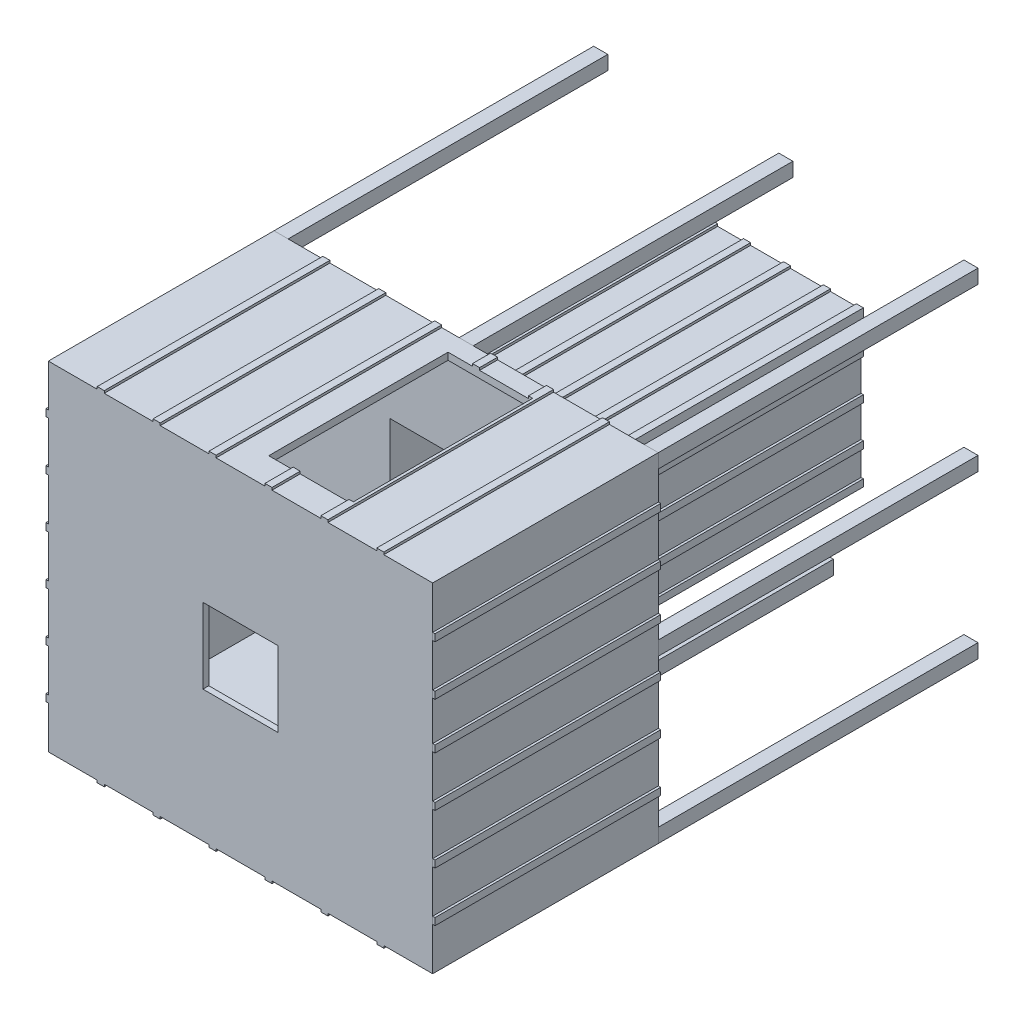
from build123d import *

# Parameters (mm, degrees)
SKETCH1_W               = 4152.9
SKETCH1_H               = 3657.6
SKETCH1_W_2             = 4000.5
SKETCH1_H_2             = 3505.2
BASE_EXTRUDE_DEPTH      = 2438.4
SKETCH2_W               = 4152.9
SKETCH2_H               = 3657.6
SKETCH2_W_2             = 1524
SKETCH2_H_2             = 1524
BOSS_EXTRUDE1_DEPTH     = 63.5
SKETCH3_W               = 4152.9
SKETCH3_H               = 3657.6
SKETCH3_W_2             = 812.8
SKETCH3_H_2             = 812.800001016
BOSS_EXTRUDE2_DEPTH     = 63.5
SKETCH4_W               = 152.4
SKETCH4_H               = 152.4
SKETCH4_W_2             = 142.875
SKETCH4_H_2             = 142.875
BOSS_EXTRUDE3_DEPTH     = 3454.4
SKETCH13_W              = 76.2
SKETCH13_H              = 2438.4
BOSS_EXTRUDE5_DEPTH     = 25.4
SKETCH15_W              = 76.2
SKETCH15_H              = 2438.4
BOSS_EXTRUDE6_DEPTH     = 25.4
SKETCH16_W              = 2438.4
SKETCH16_H              = 76.2
BOSS_EXTRUDE7_DEPTH     = 25.4
BOSS_EXTRUDE7_2_DEPTH   = 25.4
BOSS_EXTRUDE7_3_DEPTH   = 25.4
BOSS_EXTRUDE7_4_DEPTH   = 25.4
BOSS_EXTRUDE7_5_DEPTH   = 25.4
BOSS_EXTRUDE7_6_DEPTH   = 25.4
SKETCH19_W              = 2438.4
SKETCH19_H              = 76.2
BOSS_EXTRUDE8_DEPTH     = 25.4
SKETCH22_W              = 1625.6
SKETCH22_H              = 1625.6
SKETCH22_W_2            = 1524
SKETCH22_H_2            = 1524
BOSS_EXTRUDE9_DEPTH     = 3454.4
SKETCH24_W              = 76.2
SKETCH24_H              = 3454.4
BOSS_EXTRUDE10_DEPTH    = 25.4
SKETCH27_W              = 3454.4
SKETCH27_H              = 76.2
BOSS_EXTRUDE11_DEPTH    = 25.4
SKETCH28_W              = 76.2
SKETCH28_H              = 3454.4
BOSS_EXTRUDE12_DEPTH    = 25.4
SKETCH29_W              = 3454.4
SKETCH29_H              = 76.2
BOSS_EXTRUDE13_DEPTH    = 25.4
CUT_EXTRUDE5_DEPTH      = 293.37
CUT_EXTRUDE5_DEPTH_BACK = 320.04
SKETCH31_W              = 1981.2
SKETCH31_H              = 990.6
CUT_EXTRUDE6_DEPTH      = 320.04
CUT_EXTRUDE6_DEPTH_BACK = 655.574
SKETCH33_W              = 650.421428571
SKETCH33_H              = 2057.4
SKETCH33_W_2            = 527.957142858
BOSS_EXTRUDE15_DEPTH    = 119.38
BOSS_EXTRUDE16_REACH    = 4603.976


with BuildPart() as part:
    # Sketch1 → Base-Extrude (new body)
    with BuildSketch(Plane.XY):
        Rectangle(SKETCH1_W, SKETCH1_H)
        Rectangle(SKETCH1_W_2, SKETCH1_H_2, mode=Mode.SUBTRACT)
    extrude(amount=BASE_EXTRUDE_DEPTH)

    # Sketch2 → Boss-Extrude1 (add)
    with BuildSketch(Plane(origin=(0, 0, 0), x_dir=(-1, 0, 0), z_dir=(0, 0, -1))):
        Rectangle(SKETCH2_W, SKETCH2_H)
        Rectangle(SKETCH2_W_2, SKETCH2_H_2, mode=Mode.SUBTRACT)
    extrude(amount=-BOSS_EXTRUDE1_DEPTH)

    # Sketch3 → Boss-Extrude2 (add)
    with BuildSketch(Plane.XY.offset(2438.4)):
        Rectangle(SKETCH3_W, SKETCH3_H)
        Rectangle(SKETCH3_W_2, SKETCH3_H_2, mode=Mode.SUBTRACT)
    extrude(amount=-BOSS_EXTRUDE2_DEPTH)

    # Sketch4 → Boss-Extrude3 (add)
    # profile 1 of 8: a face of its own
    with BuildSketch(Plane(origin=(0, 0, 0), x_dir=(-1, 0, 0), z_dir=(0, 0, -1))):
        with Locations((2000.25, 1752.6)):
            Rectangle(SKETCH4_W, SKETCH4_H)
        with Locations((2000.25, 1752.6)):
            Rectangle(SKETCH4_W_2, SKETCH4_H_2, mode=Mode.SUBTRACT)
    # profile 2 of 8: a face of its own
    with BuildSketch(Plane(origin=(0, 0, 0), x_dir=(-1, 0, 0), z_dir=(0, 0, -1))):
        with Locations((2000.25, -1752.6)):
            Rectangle(SKETCH4_W, SKETCH4_H)
        with Locations((2000.25, -1752.6)):
            Rectangle(SKETCH4_W_2, SKETCH4_H_2, mode=Mode.SUBTRACT)
    # profile 3 of 8: a face of its own
    with BuildSketch(Plane(origin=(0, 0, 0), x_dir=(-1, 0, 0), z_dir=(0, 0, -1))):
        with Locations((-2000.25, -1752.6)):
            Rectangle(SKETCH4_W, SKETCH4_H)
        with Locations((-2000.25, -1752.6)):
            Rectangle(SKETCH4_W_2, SKETCH4_H_2, mode=Mode.SUBTRACT)
    # profile 4 of 8: a face of its own
    with BuildSketch(Plane(origin=(0, 0, 0), x_dir=(-1, 0, 0), z_dir=(0, 0, -1))):
        with Locations((-2000.25, 1752.6)):
            Rectangle(SKETCH4_W, SKETCH4_H)
        with Locations((-2000.25, 1752.6)):
            Rectangle(SKETCH4_W_2, SKETCH4_H_2, mode=Mode.SUBTRACT)
    # profile 5 of 8: a face of its own
    with BuildSketch(Plane(origin=(0, 0, 0), x_dir=(-1, 0, 0), z_dir=(0, 0, -1))):
        with Locations((0, 1752.6)):
            Rectangle(SKETCH4_W, SKETCH4_H)
        with Locations((0, 1752.6)):
            Rectangle(SKETCH4_W_2, SKETCH4_H_2, mode=Mode.SUBTRACT)
    # profile 6 of 8: a face of its own
    with BuildSketch(Plane(origin=(0, 0, 0), x_dir=(-1, 0, 0), z_dir=(0, 0, -1))):
        with Locations((-438.15, -1752.6)):
            Rectangle(SKETCH4_W, SKETCH4_H)
        with Locations((-438.15, -1752.6)):
            Rectangle(SKETCH4_W_2, SKETCH4_H_2, mode=Mode.SUBTRACT)
    # profile 7 of 8: a face of its own
    with BuildSketch(Plane(origin=(0, 0, 0), x_dir=(-1, 0, 0), z_dir=(0, 0, -1))):
        with Locations((-2000.25, 0)):
            Rectangle(SKETCH4_W, SKETCH4_H)
        with Locations((-2000.25, 0)):
            Rectangle(SKETCH4_W_2, SKETCH4_H_2, mode=Mode.SUBTRACT)
    # profile 8 of 8: a face of its own
    with BuildSketch(Plane(origin=(0, 0, 0), x_dir=(-1, 0, 0), z_dir=(0, 0, -1))):
        with Locations((2000.25, -457.2)):
            Rectangle(SKETCH4_W, SKETCH4_H)
        with Locations((2000.25, -457.2)):
            Rectangle(SKETCH4_W_2, SKETCH4_H_2, mode=Mode.SUBTRACT)
    extrude(amount=BOSS_EXTRUDE3_DEPTH)

    # Sketch13 → Boss-Extrude5 (add)
    with BuildSketch(Plane(origin=(0, 1828.8, 0), x_dir=(1, 0, 0), z_dir=(0, 1, 0))):
        with Locations((1510.392857143, -1219.2)):
            Rectangle(SKETCH13_W, SKETCH13_H)
        with Locations((-1510.392857143, -1219.2)):
            Rectangle(SKETCH13_W, SKETCH13_H)
        with Locations((-906.235714286, -1219.2)):
            Rectangle(SKETCH13_W, SKETCH13_H)
        with Locations((-302.078571429, -1219.2)):
            Rectangle(SKETCH13_W, SKETCH13_H)
        with Locations((302.078571429, -1219.2)):
            Rectangle(SKETCH13_W, SKETCH13_H)
        with Locations((906.235714286, -1219.2)):
            Rectangle(SKETCH13_W, SKETCH13_H)
    extrude(amount=BOSS_EXTRUDE5_DEPTH)

    # Sketch15 → Boss-Extrude6 (add)
    with BuildSketch(Plane.XZ.offset(1828.8)):
        with Locations((-1510.392857143, 1219.2)):
            Rectangle(SKETCH15_W, SKETCH15_H)
        with Locations((-906.235714286, 1219.2)):
            Rectangle(SKETCH15_W, SKETCH15_H)
        with Locations((-302.078571429, 1219.2)):
            Rectangle(SKETCH15_W, SKETCH15_H)
        with Locations((302.078571429, 1219.2)):
            Rectangle(SKETCH15_W, SKETCH15_H)
        with Locations((906.235714286, 1219.2)):
            Rectangle(SKETCH15_W, SKETCH15_H)
        with Locations((1510.392857143, 1219.2)):
            Rectangle(SKETCH15_W, SKETCH15_H)
    extrude(amount=BOSS_EXTRUDE6_DEPTH)

    # Sketch19 → Boss-Extrude8 (add)
    with BuildSketch(Plane.ZY.offset(2076.45)):
        with Locations((1219.2, 1333.5)):
            Rectangle(SKETCH19_W, SKETCH19_H)
        with Locations((1219.2, 800.1)):
            Rectangle(SKETCH19_W, SKETCH19_H)
        with Locations((1219.2, 266.7)):
            Rectangle(SKETCH19_W, SKETCH19_H)
        with Locations((1219.2, -266.7)):
            Rectangle(SKETCH19_W, SKETCH19_H)
        with Locations((1219.2, -800.1)):
            Rectangle(SKETCH19_W, SKETCH19_H)
        with Locations((1219.2, -1333.5)):
            Rectangle(SKETCH19_W, SKETCH19_H)
    extrude(amount=BOSS_EXTRUDE8_DEPTH)

    # Sketch22 → Boss-Extrude9 (add)
    with BuildSketch(Plane(origin=(0, 0, 0), x_dir=(-1, 0, 0), z_dir=(0, 0, -1))):
        Rectangle(SKETCH22_W, SKETCH22_H)
        Rectangle(SKETCH22_W_2, SKETCH22_H_2, mode=Mode.SUBTRACT)
    extrude(amount=BOSS_EXTRUDE9_DEPTH)

    # Sketch24 → Boss-Extrude10 (add)
    with BuildSketch(Plane.XZ.offset(812.8)):
        with Locations((-774.7, -1727.2)):
            Rectangle(SKETCH24_W, SKETCH24_H)
        with Locations((-425.45, -1727.2)):
            Rectangle(SKETCH24_W, SKETCH24_H)
        with Locations((0, -1727.2)):
            Rectangle(SKETCH24_W, SKETCH24_H)
        with Locations((425.45, -1727.2)):
            Rectangle(SKETCH24_W, SKETCH24_H)
        with Locations((774.7, -1727.2)):
            Rectangle(SKETCH24_W, SKETCH24_H)
    extrude(amount=BOSS_EXTRUDE10_DEPTH)

    # Sketch27 → Boss-Extrude11 (add)
    with BuildSketch(Plane(origin=(812.8, 0, 0), x_dir=(0, 0, -1), z_dir=(1, 0, 0))):
        with Locations((1727.2, -800.1)):
            Rectangle(SKETCH27_W, SKETCH27_H)
        with Locations((1727.2, -444.5)):
            Rectangle(SKETCH27_W, SKETCH27_H)
        with Locations((1727.2, -12.7)):
            Rectangle(SKETCH27_W, SKETCH27_H)
        with Locations((1727.2, 419.1)):
            Rectangle(SKETCH27_W, SKETCH27_H)
        with Locations((1727.2, 774.7)):
            Rectangle(SKETCH27_W, SKETCH27_H)
    extrude(amount=BOSS_EXTRUDE11_DEPTH)

    # Sketch28 → Boss-Extrude12 (add)
    with BuildSketch(Plane(origin=(0, 812.8, 0), x_dir=(1, 0, 0), z_dir=(0, 1, 0))):
        with Locations((800.1, 1727.2)):
            Rectangle(SKETCH28_W, SKETCH28_H)
        with Locations((444.5, 1727.2)):
            Rectangle(SKETCH28_W, SKETCH28_H)
        with Locations((12.7, 1727.2)):
            Rectangle(SKETCH28_W, SKETCH28_H)
        with Locations((-419.1, 1727.2)):
            Rectangle(SKETCH28_W, SKETCH28_H)
        with Locations((-774.7, 1727.2)):
            Rectangle(SKETCH28_W, SKETCH28_H)
    extrude(amount=BOSS_EXTRUDE12_DEPTH)

    # Sketch29 → Boss-Extrude13 (add)
    with BuildSketch(Plane.ZY.offset(812.8)):
        with Locations((-1727.2, 800.1)):
            Rectangle(SKETCH29_W, SKETCH29_H)
        with Locations((-1727.2, 438.15)):
            Rectangle(SKETCH29_W, SKETCH29_H)
        with Locations((-1727.2, 0)):
            Rectangle(SKETCH29_W, SKETCH29_H)
        with Locations((-1727.2, -438.15)):
            Rectangle(SKETCH29_W, SKETCH29_H)
        with Locations((-1727.2, -800.1)):
            Rectangle(SKETCH29_W, SKETCH29_H)
    extrude(amount=BOSS_EXTRUDE13_DEPTH)

    # Sketch31 → Cut-Extrude5 (cut, two sides: drawn at the far end of the back side and taken through both)
    with BuildSketch(Plane.ZY.offset(812.8).offset(-CUT_EXTRUDE5_DEPTH_BACK)):
        with Locations((-2463.8, 1.918378141)):
            Rectangle(SKETCH31_W, SKETCH31_H)
    extrude(amount=CUT_EXTRUDE5_DEPTH + CUT_EXTRUDE5_DEPTH_BACK, mode=Mode.SUBTRACT)

    # Sketch33 → Cut-Extrude6 (cut, two sides: drawn at the far end of the back side and taken through both)
    with BuildSketch(Plane(origin=(0, 1828.8, 0), x_dir=(1, 0, 0), z_dir=(0, 1, 0)).offset(-CUT_EXTRUDE6_DEPTH_BACK)):
        with Locations((589.189285715, -1104.9)):
            Rectangle(SKETCH33_W, SKETCH33_H)
        with Locations((0, -1104.9)):
            Rectangle(SKETCH33_W_2, SKETCH33_H)
        with Locations((-589.189285715, -1104.9)):
            Rectangle(SKETCH33_W, SKETCH33_H)
    extrude(amount=CUT_EXTRUDE6_DEPTH + CUT_EXTRUDE6_DEPTH_BACK, mode=Mode.SUBTRACT)

    # Sketch34 → Boss-Extrude15 (add)
    with BuildSketch(Plane.XY.offset(76.2)):
        Polygon((914.4, 1752.6), (914.4, 1854.2), (868.135714286, 1854.2), (868.135714286, 1828.8), (340.178571429, 1828.8), (340.178571429, 1854.2), (263.978571429, 1854.2), (263.978571429, 1828.8), (-263.978571429, 1828.8), (-263.978571429, 1854.2), (-340.178571429, 1854.2), (-340.178571429, 1828.8), (-868.135714286, 1828.8), (-868.135714286, 1854.2), (-914.4, 1854.2), (-914.4, 1752.6), align=None)
    extrude(amount=BOSS_EXTRUDE15_DEPTH)

    # Sketch35 → Boss-Extrude16 (add, up to next)
    with BuildSketch(Plane.XY.offset(195.58), mode=Mode.PRIVATE) as boss_extrude16_sk1:
        Polygon((0, 1828.8), (0, 1752.6), (-914.4, 1752.6), (-914.4, 1854.2), (-868.135714286, 1854.2), (-868.135714286, 1828.8), (-340.178571429, 1828.8), (-340.178571429, 1854.2), (-263.978571429, 1854.2), (-263.978571429, 1828.8), align=None)
    boss_extrude16_tool1 = extrude(boss_extrude16_sk1.sketch, amount=BOSS_EXTRUDE16_REACH, mode=Mode.PRIVATE) - part.part
    add(boss_extrude16_tool1.solids().sort_by_distance((-460.082957, 1792.87094, 195.58))[0])


with BuildPart() as body_2:
    # Sketch16 → Boss-Extrude7 (new body)
    with BuildSketch(Plane(origin=(2076.45, 0, 0), x_dir=(0, 0, -1), z_dir=(1, 0, 0))):
        with Locations((-1219.2, -1328.240745547)):
            Rectangle(SKETCH16_W, SKETCH16_H)
    extrude(amount=BOSS_EXTRUDE7_DEPTH)


with BuildPart() as body_3:
    # Sketch16 → Boss-Extrude7 2 (new body)
    with BuildSketch(Plane(origin=(2076.45, 0, 0), x_dir=(0, 0, -1), z_dir=(1, 0, 0))):
        with Locations((-1219.2, -789.581491095)):
            Rectangle(SKETCH16_W, SKETCH16_H)
    extrude(amount=BOSS_EXTRUDE7_2_DEPTH)


with BuildPart() as body_4:
    # Sketch16 → Boss-Extrude7 3 (new body)
    with BuildSketch(Plane(origin=(2076.45, 0, 0), x_dir=(0, 0, -1), z_dir=(1, 0, 0))):
        with Locations((-1219.2, -250.922236642)):
            Rectangle(SKETCH16_W, SKETCH16_H)
    extrude(amount=BOSS_EXTRUDE7_3_DEPTH)


with BuildPart() as body_5:
    # Sketch16 → Boss-Extrude7 4 (new body)
    with BuildSketch(Plane(origin=(2076.45, 0, 0), x_dir=(0, 0, -1), z_dir=(1, 0, 0))):
        with Locations((-1219.2, 287.737017811)):
            Rectangle(SKETCH16_W, SKETCH16_H)
    extrude(amount=BOSS_EXTRUDE7_4_DEPTH)


with BuildPart() as body_6:
    # Sketch16 → Boss-Extrude7 5 (new body)
    with BuildSketch(Plane(origin=(2076.45, 0, 0), x_dir=(0, 0, -1), z_dir=(1, 0, 0))):
        with Locations((-1219.2, 789.581491095)):
            Rectangle(SKETCH16_W, SKETCH16_H)
    extrude(amount=BOSS_EXTRUDE7_5_DEPTH)


with BuildPart() as body_7:
    # Sketch16 → Boss-Extrude7 6 (new body)
    with BuildSketch(Plane(origin=(2076.45, 0, 0), x_dir=(0, 0, -1), z_dir=(1, 0, 0))):
        with Locations((-1219.2, 1328.240745547)):
            Rectangle(SKETCH16_W, SKETCH16_H)
    extrude(amount=BOSS_EXTRUDE7_6_DEPTH)


solid = Compound([part.part, body_2.part, body_3.part, body_4.part, body_5.part, body_6.part, body_7.part])
